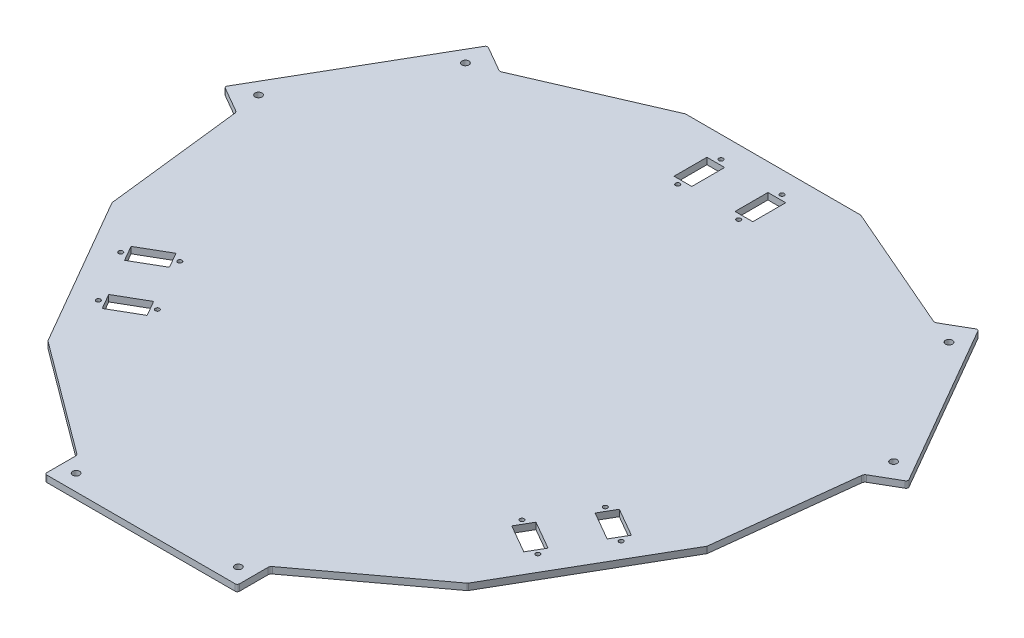
from build123d import *

# Parameters (mm, degrees)
EXTRUDE_2_DEPTH          = 1.5
FILLET_1_R               = 1
SKETCH_3_R               = 1.6
CUT_EXTRUDE_1_DEPTH      = 223.320913296
CUT_EXTRUDE_2_DEPTH      = 223.320913296
CUT_EXTRUDE_2_DEPTH_BACK = 223.320913296
SKETCH_4_R               = 1.6
SKETCH_5_R               = 1
CUT_EXTRUDE_3_DEPTH      = 223.320913296
PATTERN_CIRCULAR_1_COUNT = 3


with BuildPart() as part:
    # ｽｹｯﾁ1 → ﾎﾞｽ - 押し出し2 (new, symmetric)
    with BuildSketch(Plane(origin=(0, 0, 0), x_dir=(1, 0, 0), z_dir=(0, 1, 0))):
        with BuildLine():
            Line((97.009839672, -102.774028853), (137.509839672, -32.625971147))
            Line((137.509839672, -32.625971147), (144.908849563, 31.451334131))
            ThreePointArc((144.908849563, 31.451334131), (145.184524529, 32.21121649), (145.772298281, 32.76613982))
            Line((145.772298281, 32.76613982), (158.000220729, 39.825934137))
            Line((158.000220729, 39.825934137), (113.490381057, 116.919237886))
            Line((113.490381057, 116.919237886), (101.262458609, 109.85944357))
            ThreePointArc((101.262458609, 109.85944357), (100.487994031, 109.627878233), (99.692079121, 109.769077889))
            Line((99.692079121, 109.769077889), (40.5, 135.4))
            Line((40.5, 135.4), (-40.5, 135.4))
            Line((-40.5, 135.4), (-99.692079121, 109.769077889))
            ThreePointArc((-99.692079121, 109.769077889), (-100.487994031, 109.627878233), (-101.262458609, 109.85944357))
            Line((-101.262458609, 109.85944357), (-113.490381057, 116.919237886))
            Line((-113.490381057, 116.919237886), (-158.000220729, 39.825934137))
            Line((-158.000220729, 39.825934137), (-145.772298281, 32.76613982))
            ThreePointArc((-145.772298281, 32.76613982), (-145.184524529, 32.21121649), (-144.908849563, 31.451334131))
            Line((-144.908849563, 31.451334131), (-137.509839672, -32.625971147))
            Line((-137.509839672, -32.625971147), (-97.009839672, -102.774028853))
            Line((-97.009839672, -102.774028853), (-45.216770441, -141.22041202))
            ThreePointArc((-45.216770441, -141.22041202), (-44.696530497, -141.839094723), (-44.509839672, -142.62558339))
            Line((-44.509839672, -142.62558339), (-44.509839672, -156.745172024))
            Line((-44.509839672, -156.745172024), (44.509839672, -156.745172024))
            Line((44.509839672, -156.745172024), (44.509839672, -142.62558339))
            ThreePointArc((44.509839672, -142.62558339), (44.696530497, -141.839094723), (45.216770441, -141.22041202))
            Line((45.216770441, -141.22041202), (97.009839672, -102.774028853))
        make_face()
    extrude(amount=EXTRUDE_2_DEPTH, both=True)

    # ﾌｨﾚｯﾄ1
    fillet_1_edges = [part.edges().sort_by_distance(p)[0] for p in [
        (-158.000220729, 0, -39.825934137),
        (-113.490381057, 0, -116.919237886),
        (113.490381057, 0, -116.919237886),
        (158.000220729, 0, -39.825934137),
        (-40.5, 0, -135.4),
        (40.5, 0, -135.4),
        (137.509839672, 0, 32.625971147),
        (97.009839672, 0, 102.774028853),
        (44.509839672, 0, 156.745172024),
        (-44.509839672, 0, 156.745172024),
        (-97.009839672, 0, 102.774028853),
        (-137.509839672, 0, 32.625971147),
    ]]
    fillet(fillet_1_edges, radius=FILLET_1_R)

    # ｽｹｯﾁ3 → ｶｯﾄ - 押し出し1 (cut, symmetric)
    with BuildSketch(Plane.XZ.offset(1.5)):
        with Locations((111.750110365, -104.933475144)):
            Circle(SKETCH_3_R)
        with Locations((146.750110365, -44.311696879)):
            Circle(SKETCH_3_R)
    cut_extrude_1 = extrude(amount=CUT_EXTRUDE_1_DEPTH, both=True, mode=Mode.SUBTRACT)

    # ﾐﾗｰ1: ｶｯﾄ - 押し出し1 across plane
    add(cut_extrude_1.mirror(Plane(origin=(0, 0, 0), x_dir=(0, 0, 1), z_dir=(1, 0, 0))), mode=Mode.SUBTRACT)

    # ｽｹｯﾁ4 → ｶｯﾄ - 押し出し2 (cut, two sides: drawn at the far end of the back side and taken through both)
    with BuildSketch(Plane.XZ.offset(1.5).offset(-CUT_EXTRUDE_2_DEPTH_BACK)):
        with Locations((37.500160328, 149.245172024)):
            Circle(SKETCH_4_R)
        with Locations((-37.499839672, 149.250171422)):
            Circle(SKETCH_4_R)
    extrude(amount=CUT_EXTRUDE_2_DEPTH + CUT_EXTRUDE_2_DEPTH_BACK, mode=Mode.SUBTRACT)

    # ｽｹｯﾁ5 → ｶｯﾄ - 押し出し3 (cut, symmetric)
    with BuildSketch(Plane(origin=(0, 1.5, 0), x_dir=(1, 0, 0), z_dir=(0, 1, 0))):
        with Locations((-98.329077559, -40.489041807)):
            Circle(SKETCH_5_R)
        with Locations((-115.649585635, -50.489041807)):
            Circle(SKETCH_5_R)
        with Locations((-101.549585635, -74.910958193)):
            Circle(SKETCH_5_R)
        with Locations((-84.229077559, -64.910958193)):
            Circle(SKETCH_5_R)
        Polygon((-115.621124665, -45.738337651), (-102.457538528, -38.138337651), (-98.357538528, -45.239745962), (-111.521124665, -52.839745962), align=None)
        Polygon((-101.521124665, -70.160254038), (-97.421124665, -77.261662349), (-84.257538528, -69.661662349), (-88.357538528, -62.560254038), align=None)
    cut_extrude_3 = extrude(amount=CUT_EXTRUDE_3_DEPTH, both=True, mode=Mode.SUBTRACT)

    # 円形ﾊﾟﾀｰﾝ1: ｶｯﾄ - 押し出し3 ×3 about axis
    pattern_circular_1_axis = Axis((0, 1.65, 0), (0, -1, 0))
    for i in range(1, PATTERN_CIRCULAR_1_COUNT):
        add(cut_extrude_3.rotate(pattern_circular_1_axis, i * 360 / PATTERN_CIRCULAR_1_COUNT), mode=Mode.SUBTRACT)


solid = part.part
